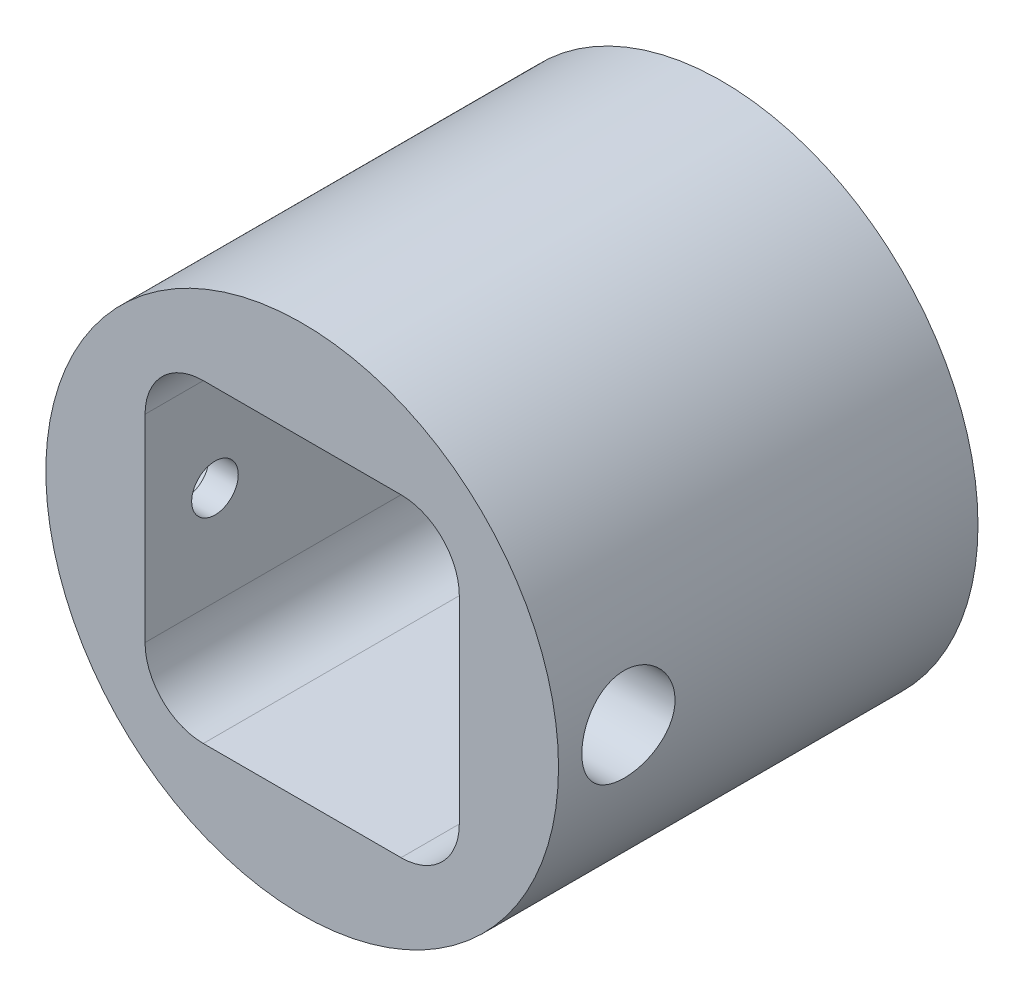
from build123d import *

# Parameters (mm, degrees)
SKETCH1_R               = 11
SKETCH1_R_2             = 1.5
BOSS_EXTRUDE1_DEPTH     = 18
CUT_EXTRUDE2_DEPTH      = 24.790754507
CUT_EXTRUDE2_DEPTH_BACK = 24.790754507
SKETCH3_R               = 1
CUT_EXTRUDE3_START      = -8
SKETCH4_R               = 2
CUT_EXTRUDE3_DEPTH      = 5
CUT_EXTRUDE4_START      = 13
SKETCH4_2_R             = 2
CUT_EXTRUDE4_DEPTH      = 5
CUT_EXTRUDE5_DEPTH      = 16


with BuildPart() as part:
    # Sketch1 → Boss-Extrude1 (new body)
    with BuildSketch(Plane.XY):
        Circle(SKETCH1_R)
        with Locations((-4.242640687, 4.242640687)):
            Circle(SKETCH1_R_2, mode=Mode.SUBTRACT)
        with Locations((4.242640687, 4.242640687)):
            Circle(SKETCH1_R_2, mode=Mode.SUBTRACT)
        with Locations((4.242640687, -4.242640687)):
            Circle(SKETCH1_R_2, mode=Mode.SUBTRACT)
        with Locations((-4.242640687, -4.242640687)):
            Circle(SKETCH1_R_2, mode=Mode.SUBTRACT)
    extrude(amount=BOSS_EXTRUDE1_DEPTH)

    # Sketch3 → Cut-Extrude2 (cut, two sides: drawn at the far end of the back side and taken through both)
    with BuildSketch(Plane(origin=(0, 0, 0), x_dir=(0, 0, -1), z_dir=(1, 0, 0)).offset(-CUT_EXTRUDE2_DEPTH_BACK)):
        with Locations((-15, 0)):
            Circle(SKETCH3_R)
    extrude(amount=CUT_EXTRUDE2_DEPTH + CUT_EXTRUDE2_DEPTH_BACK, mode=Mode.SUBTRACT)

    # Sketch4 → Cut-Extrude3 (cut)
    with BuildSketch(Plane(origin=(0, 0, 0), x_dir=(0, 0, -1), z_dir=(1, 0, 0)).offset(CUT_EXTRUDE3_START)):
        with Locations((-15, 0)):
            Circle(SKETCH4_R)
    extrude(amount=-CUT_EXTRUDE3_DEPTH, mode=Mode.SUBTRACT)

    # Sketch4<2> → Cut-Extrude4 (cut)
    with BuildSketch(Plane(origin=(0, 0, 0), x_dir=(0, 0, -1), z_dir=(1, 0, 0)).offset(CUT_EXTRUDE4_START)):
        with Locations((-15, 0)):
            Circle(SKETCH4_2_R)
    extrude(amount=-CUT_EXTRUDE4_DEPTH, mode=Mode.SUBTRACT)

    # Sketch2 → Cut-Extrude5 (cut)
    with BuildSketch(Plane.XY.offset(18)):
        with BuildLine():
            Line((4.242640687, 6.742640687), (-4.242640687, 6.742640687))
            ThreePointArc((-4.242640687, 6.742640687), (-6.01040764, 6.01040764), (-6.742640687, 4.242640687))
            Line((-6.742640687, 4.242640687), (-6.742640687, -4.242640687))
            ThreePointArc((-6.742640687, -4.242640687), (-6.01040764, -6.01040764), (-4.242640687, -6.742640687))
            Line((-4.242640687, -6.742640687), (4.242640687, -6.742640687))
            ThreePointArc((4.242640687, -6.742640687), (6.01040764, -6.01040764), (6.742640687, -4.242640687))
            Line((6.742640687, -4.242640687), (6.742640687, 4.242640687))
            ThreePointArc((6.742640687, 4.242640687), (6.01040764, 6.01040764), (4.242640687, 6.742640687))
        make_face()
    extrude(amount=-CUT_EXTRUDE5_DEPTH, mode=Mode.SUBTRACT)


solid = part.part
